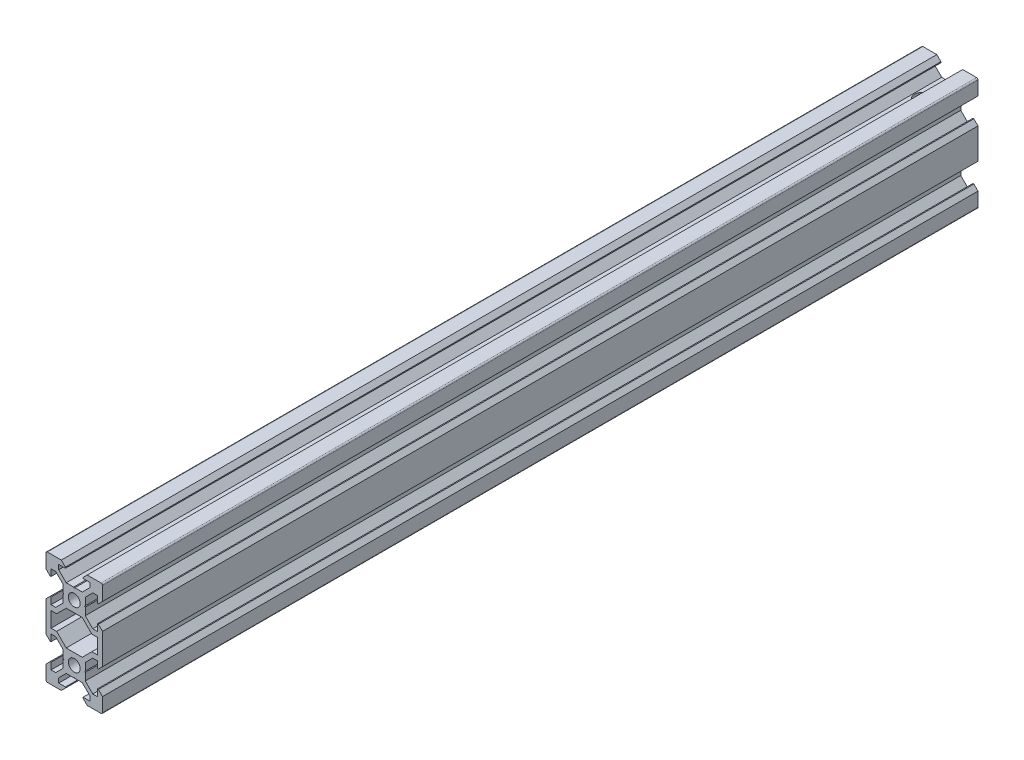
from build123d import *

# Parameters (mm, degrees)
ESBO_O1_R                = 2.1
RESSALTO_EXTRUS_O1_DEPTH = 310
CORTE_EXTRUS_O1_REACH    = 314.73
ESBO_O3_R                = 2.5


with BuildPart() as part:
    # Esboço1 → Ressalto-extrusão1 (new body)
    with BuildSketch(Plane.XY):
        with BuildLine():
            Line((3.9, 9.79), (3.69, 10))
            Line((3.69, 10), (3.9, 10.21))
            Line((3.9, 10.21), (3.9, 12.839339828))
            Line((3.9, 12.839339828), (6.560660172, 15.5))
            Line((6.560660172, 15.5), (8.2, 15.5))
            Line((8.2, 15.5), (8.2, 13.125))
            Line((8.2, 13.125), (8.545, 13.125))
            Line((8.545, 13.125), (10, 14.58))
            Line((10, 14.58), (10, 19.5))
            ThreePointArc((10, 19.5), (9.853553391, 19.853553391), (9.5, 20))
            Line((9.5, 20), (4.58, 20))
            Line((4.58, 20), (3.125, 18.545))
            Line((3.125, 18.545), (3.125, 18.2))
            Line((3.125, 18.2), (5.5, 18.2))
            Line((5.5, 18.2), (5.5, 16.560660172))
            Line((5.5, 16.560660172), (2.839339828, 13.9))
            Line((2.839339828, 13.9), (0.21, 13.9))
            Line((0.21, 13.9), (0, 13.69))
            Line((0, 13.69), (-0.21, 13.9))
            Line((-0.21, 13.9), (-2.839339828, 13.9))
            Line((-2.839339828, 13.9), (-5.5, 16.560660172))
            Line((-5.5, 16.560660172), (-5.5, 18.2))
            Line((-5.5, 18.2), (-3.125, 18.2))
            Line((-3.125, 18.2), (-3.125, 18.545))
            Line((-3.125, 18.545), (-4.58, 20))
            Line((-4.58, 20), (-9.5, 20))
            ThreePointArc((-9.5, 20), (-9.853553391, 19.853553391), (-10, 19.5))
            Line((-10, 19.5), (-10, 14.58))
            Line((-10, 14.58), (-8.545, 13.125))
            Line((-8.545, 13.125), (-8.2, 13.125))
            Line((-8.2, 13.125), (-8.2, 15.5))
            Line((-8.2, 15.5), (-6.560660172, 15.5))
            Line((-6.560660172, 15.5), (-3.9, 12.839339828))
            Line((-3.9, 12.839339828), (-3.9, 10.21))
            Line((-3.9, 10.21), (-3.69, 10))
            Line((-3.69, 10), (-3.9, 9.79))
            Line((-3.9, 9.79), (-3.9, 7.160660172))
            Line((-3.9, 7.160660172), (-6.560660172, 4.5))
            Line((-6.560660172, 4.5), (-8.2, 4.5))
            Line((-8.2, 4.5), (-8.2, 6.875))
            Line((-8.2, 6.875), (-8.545, 6.875))
            Line((-8.545, 6.875), (-10, 5.42))
            Line((-10, 5.42), (-10, -5.42))
            Line((-10, -5.42), (-8.545, -6.875))
            Line((-8.545, -6.875), (-8.2, -6.875))
            Line((-8.2, -6.875), (-8.2, -4.5))
            Line((-8.2, -4.5), (-6.560660172, -4.5))
            Line((-6.560660172, -4.5), (-3.9, -7.160660172))
            Line((-3.9, -7.160660172), (-3.9, -9.79))
            Line((-3.9, -9.79), (-3.69, -10))
            Line((-3.69, -10), (-3.9, -10.21))
            Line((-3.9, -10.21), (-3.9, -12.839339828))
            Line((-3.9, -12.839339828), (-6.560660172, -15.5))
            Line((-6.560660172, -15.5), (-8.2, -15.5))
            Line((-8.2, -15.5), (-8.2, -13.125))
            Line((-8.2, -13.125), (-8.545, -13.125))
            Line((-8.545, -13.125), (-10, -14.58))
            Line((-10, -14.58), (-10, -19.5))
            ThreePointArc((-10, -19.5), (-9.853553391, -19.853553391), (-9.5, -20))
            Line((-9.5, -20), (-4.58, -20))
            Line((-4.58, -20), (-3.125, -18.545))
            Line((-3.125, -18.545), (-3.125, -18.2))
            Line((-3.125, -18.2), (-5.5, -18.2))
            Line((-5.5, -18.2), (-5.5, -16.560660172))
            Line((-5.5, -16.560660172), (-2.839339828, -13.9))
            Line((-2.839339828, -13.9), (-0.21, -13.9))
            Line((-0.21, -13.9), (0, -13.69))
            Line((0, -13.69), (0.21, -13.9))
            Line((0.21, -13.9), (2.839339828, -13.9))
            Line((2.839339828, -13.9), (5.5, -16.560660172))
            Line((5.5, -16.560660172), (5.5, -18.2))
            Line((5.5, -18.2), (3.125, -18.2))
            Line((3.125, -18.2), (3.125, -18.545))
            Line((3.125, -18.545), (4.58, -20))
            Line((4.58, -20), (9.5, -20))
            ThreePointArc((9.5, -20), (9.853553391, -19.853553391), (10, -19.5))
            Line((10, -19.5), (10, -14.58))
            Line((10, -14.58), (8.545, -13.125))
            Line((8.545, -13.125), (8.2, -13.125))
            Line((8.2, -13.125), (8.2, -15.5))
            Line((8.2, -15.5), (6.560660172, -15.5))
            Line((6.560660172, -15.5), (3.9, -12.839339828))
            Line((3.9, -12.839339828), (3.9, -10.21))
            Line((3.9, -10.21), (3.69, -10))
            Line((3.69, -10), (3.9, -9.79))
            Line((3.9, -9.79), (3.9, -7.160660172))
            Line((3.9, -7.160660172), (6.560660172, -4.5))
            Line((6.560660172, -4.5), (8.2, -4.5))
            Line((8.2, -4.5), (8.2, -6.875))
            Line((8.2, -6.875), (8.545, -6.875))
            Line((8.545, -6.875), (10, -5.42))
            Line((10, -5.42), (10, 5.42))
            Line((10, 5.42), (8.545, 6.875))
            Line((8.545, 6.875), (8.2, 6.875))
            Line((8.2, 6.875), (8.2, 4.5))
            Line((8.2, 4.5), (6.560660172, 4.5))
            Line((6.560660172, 4.5), (3.9, 7.160660172))
            Line((3.9, 7.160660172), (3.9, 9.79))
        make_face()
        with Locations((0, -10)):
            Circle(ESBO_O1_R, mode=Mode.SUBTRACT)
        with Locations((0, 10)):
            Circle(ESBO_O1_R, mode=Mode.SUBTRACT)
        Polygon((8.2, -2.7), (8.2, 2.7), (6.239339828, 2.7), (2.839339828, 6.1), (-2.839339828, 6.1), (-6.239339828, 2.7), (-8.2, 2.7), (-8.2, -2.7), (-6.239339828, -2.7), (-2.839339828, -6.1), (2.839339828, -6.1), (6.239339828, -2.7), align=None, mode=Mode.SUBTRACT)
    extrude(amount=RESSALTO_EXTRUS_O1_DEPTH)

    # Corte-extrusão1: up to this face of the body (flat: up to its plane)
    corte_extrus_o1_end = Plane(part.part.faces().sort_by_distance((-7.04, 20, 155))[0])
    # Esboço3 → Corte-extrusão1 (cut, up to the picked face)
    with BuildSketch(Plane.XZ.offset(20), mode=Mode.PRIVATE) as corte_extrus_o1_sk1:
        with Locations(Location((0, 10, 0), (0, 0, 90))):
            Circle(ESBO_O3_R)
    corte_extrus_o1_tool1 = split(extrude(corte_extrus_o1_sk1.sketch, amount=-CORTE_EXTRUS_O1_REACH, mode=Mode.PRIVATE), bisect_by=corte_extrus_o1_end, keep=Keep.BOTH, mode=Mode.PRIVATE)
    add(corte_extrus_o1_tool1.solids().sort_by(Axis((0, -20, 10), (0, 1, 0)))[0], mode=Mode.SUBTRACT)


solid = part.part
